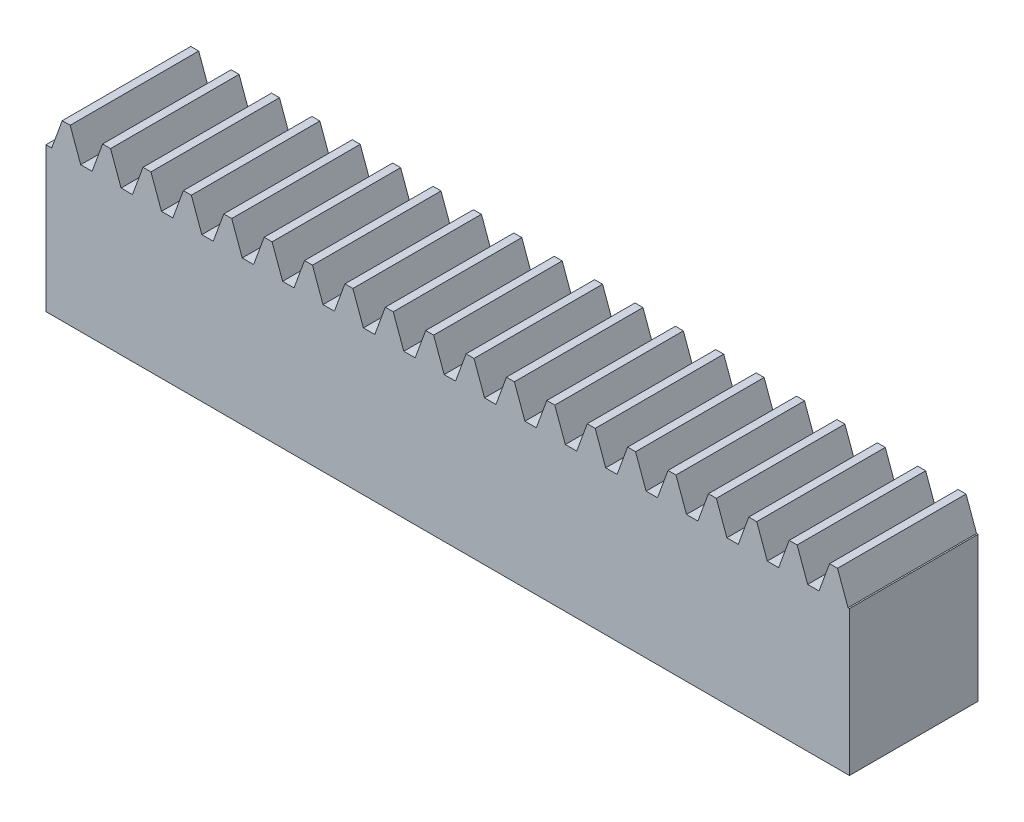
from build123d import *

# Parameters (mm, degrees)
BLANKSKE_W        = 50
BLANKSKE_H        = 10.8
BLANK_DEPTH       = 8
TOOTHCUTSIM_DEPTH = 52.774897392
TEETHCUTS_COUNT   = 21
TEETHCUTS_PITCH   = 2.51327412


with BuildPart() as part:
    # BlankSke → Blank (new body)
    with BuildSketch(Plane.XY):
        with Locations((25, 5.4)):
            Rectangle(BLANKSKE_W, BLANKSKE_H)
    extrude(amount=-BLANK_DEPTH)

    # TooCutSkeSim → ToothCutSim (cut, through all)
    with BuildSketch(Plane.XY):
        Polygon((0.354348296, 9), (-0.354348296, 9), (-1.018739561, 10.8254), (1.018739561, 10.8254), align=None)
    toothcutsim = extrude(amount=-TOOTHCUTSIM_DEPTH, mode=Mode.SUBTRACT)

    # TeethCuts: ToothCutSim ×21
    with Locations(*[(i * TEETHCUTS_PITCH, 0, 0) for i in range(1, TEETHCUTS_COUNT)]):
        add(toothcutsim, mode=Mode.SUBTRACT)


solid = part.part
